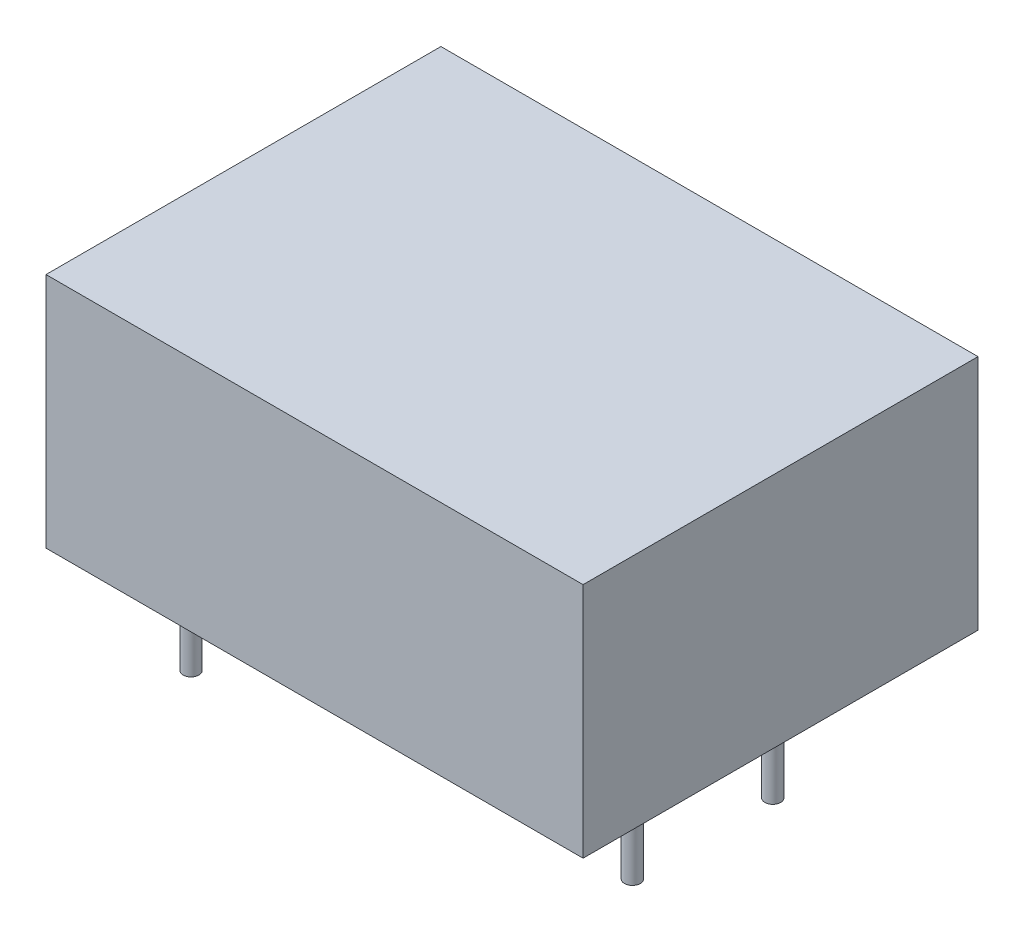
from build123d import *

# Parameters (mm, degrees)
SKETCH_1_W      = 34
SKETCH_1_H      = 25
EXTRUDE_1_DEPTH = 15
SKETCH_2_R      = 0.5
EXTRUDE_2_DEPTH = 7


with BuildPart() as part:
    # 草图1 → 凸台-拉伸1 (new body)
    with BuildSketch(Plane(origin=(0, 0, 0), x_dir=(1, 0, 0), z_dir=(0, 1, 0))):
        Rectangle(SKETCH_1_W, SKETCH_1_H)
    extrude(amount=EXTRUDE_1_DEPTH)

    # 草图2 → 凸台-拉伸2 (add)
    with BuildSketch(Plane(origin=(0, 0, 0), x_dir=(1, 0, 0), z_dir=(0, 1, 0))):
        with Locations(Location((-12.7, 7.62, 0), (0, 0, 270))):
            Circle(SKETCH_2_R)
        with Locations(Location((-12.7, -7.62, 0), (0, 0, 270))):
            Circle(SKETCH_2_R)
        with Locations(Location((12.7, 3.81, 0), (0, 0, 270))):
            Circle(SKETCH_2_R)
        with Locations(Location((12.7, -5.08, 0), (0, 0, 270))):
            Circle(SKETCH_2_R)
    extrude(amount=-EXTRUDE_2_DEPTH)


solid = part.part
